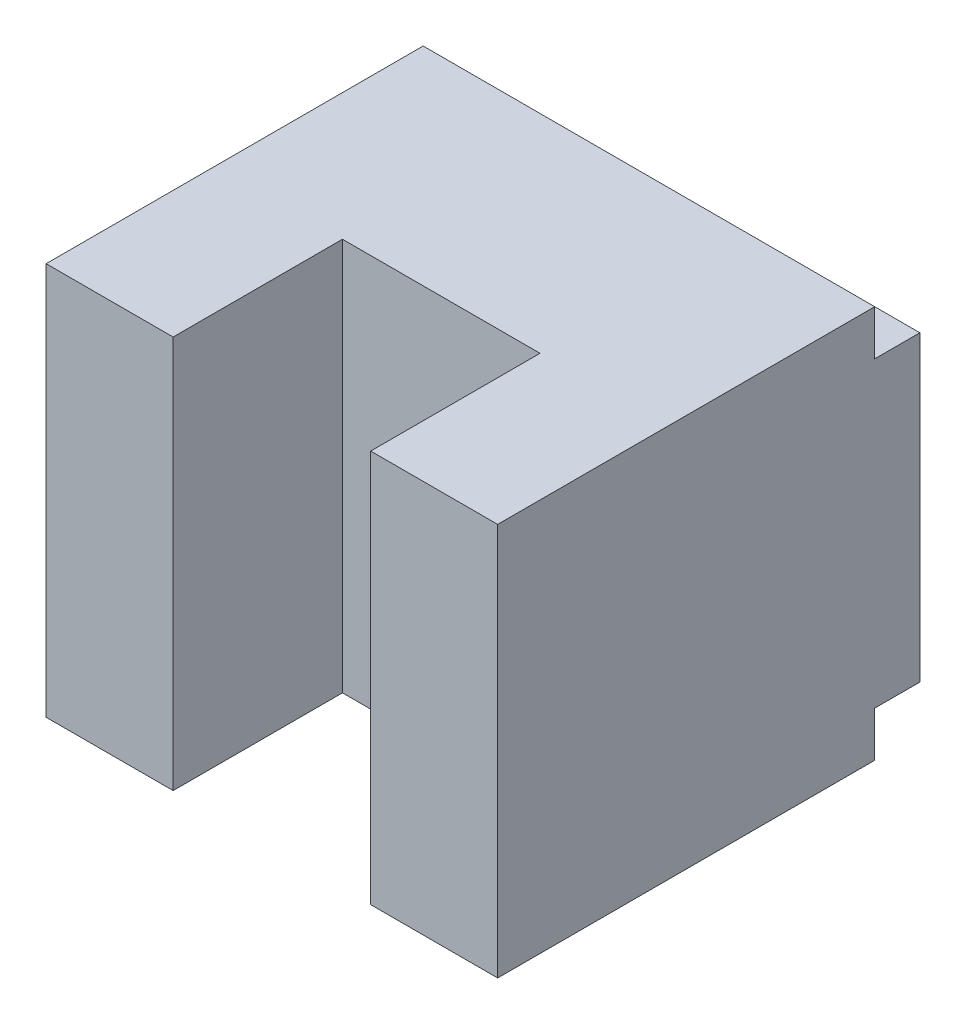
from build123d import *

# Parameters (mm, degrees)
SKETCH1_W               = 25.4
SKETCH1_H               = 22.098
SKETCH1_R               = 3.175
BOSS_EXTRUDE1_DEPTH     = 23.749
SKETCH2_W               = 11.1125
SKETCH2_H               = 22.098
CUT_EXTRUDE1_DEPTH      = 9.525
CUT_EXTRUDE2_DEPTH      = 30.109884953
CUT_EXTRUDE2_DEPTH_BACK = 30.109884953
SKETCH3_W               = 2.54
SKETCH3_H               = 2.54


with BuildPart() as part:
    # Sketch1 → Boss-Extrude1 (new body)
    with BuildSketch(Plane.XY):
        Rectangle(SKETCH1_W, SKETCH1_H)
        with Locations(Location((0, 0, 0), (0, 0, 180))):
            Circle(SKETCH1_R, mode=Mode.SUBTRACT)
    extrude(amount=BOSS_EXTRUDE1_DEPTH)

    # Sketch2 → Cut-Extrude1 (cut)
    with BuildSketch(Plane.XY.offset(23.749)):
        Rectangle(SKETCH2_W, SKETCH2_H)
    extrude(amount=-CUT_EXTRUDE1_DEPTH, mode=Mode.SUBTRACT)

    # Sketch3 → Cut-Extrude2 (cut, two sides: drawn at the far end of the back side and taken through both)
    with BuildSketch(Plane(origin=(0, 0, 0), x_dir=(0, 0, -1), z_dir=(1, 0, 0)).offset(-CUT_EXTRUDE2_DEPTH_BACK)):
        with Locations((-1.27, 9.779)):
            Rectangle(SKETCH3_W, SKETCH3_H)
        with Locations((-1.27, -9.779)):
            Rectangle(SKETCH3_W, SKETCH3_H)
    extrude(amount=CUT_EXTRUDE2_DEPTH + CUT_EXTRUDE2_DEPTH_BACK, mode=Mode.SUBTRACT)


solid = part.part
